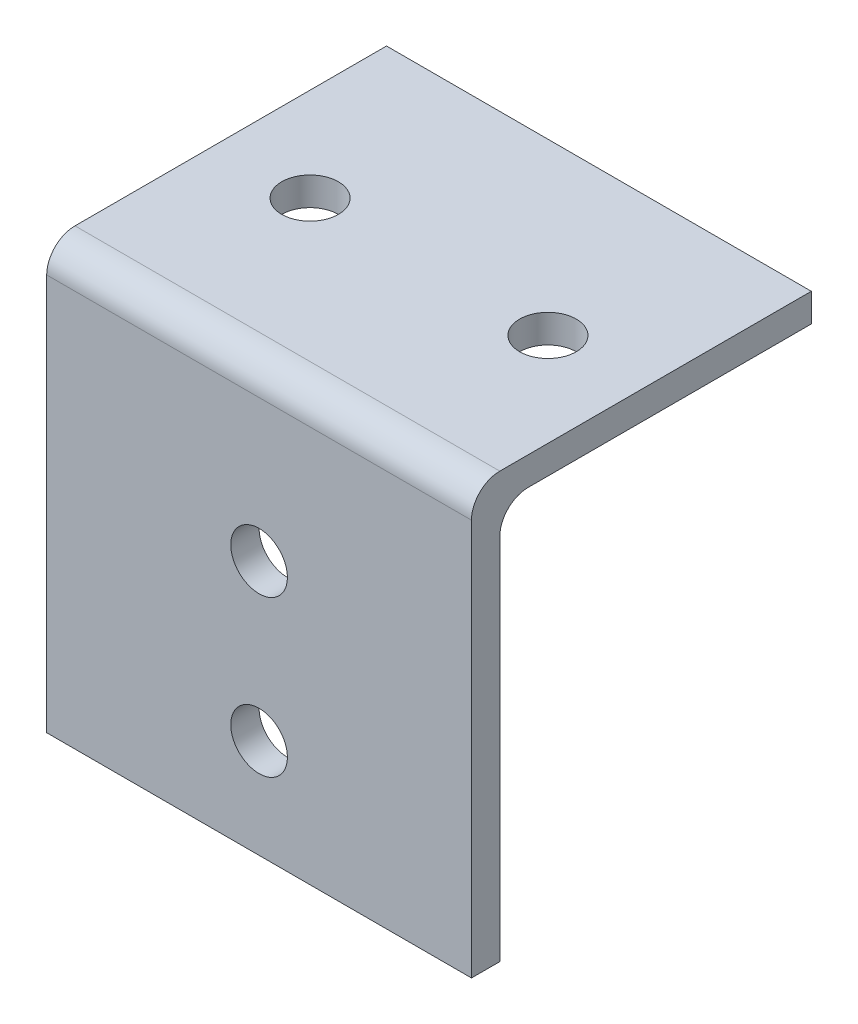
from build123d import *

# Parameters (mm, degrees)
SKETCH1_R           = 2.54
BOSS_EXTRUDE1_DEPTH = 2.54
SKETCH2_W           = 38.1
SKETCH2_H           = 38.1
SKETCH2_R           = 2.54
BOSS_EXTRUDE2_DEPTH = 2.54
FILLET2_R           = 2.54
FILLET3_R           = 2.54


with BuildPart() as part:
    # Sketch1 → Boss-Extrude1 (new body)
    with BuildSketch(Plane(origin=(0, 0, 0), x_dir=(1, 0, 0), z_dir=(0, 1, 0))):
        Polygon((-19.583364039, 14.230768135), (-5.08, 14.230768135), (5.08, 14.230768135), (18.516635961, 14.230768135), (18.516635961, -13.709231865), (-19.583364039, -13.709231865), align=None)
        with Locations(Location((-11.201364039, -1.009231865, 0), (0, 0, 270))):
            Circle(SKETCH1_R, mode=Mode.SUBTRACT)
        with Locations(Location((10.134635961, -1.009231865, 0), (0, 0, 270))):
            Circle(SKETCH1_R, mode=Mode.SUBTRACT)
    extrude(amount=BOSS_EXTRUDE1_DEPTH)

    # Sketch2 → Boss-Extrude2 (add)
    with BuildSketch(Plane.XY.offset(13.709231865)):
        with Locations((-0.533364039, -16.51)):
            Rectangle(SKETCH2_W, SKETCH2_H)
        with Locations((-0.533364039, -12.7)):
            Circle(SKETCH2_R, mode=Mode.SUBTRACT)
        with Locations((-0.533364039, -26.67)):
            Circle(SKETCH2_R, mode=Mode.SUBTRACT)
    extrude(amount=BOSS_EXTRUDE2_DEPTH)

    # Fillet2
    fillet2_edges = [part.edges().sort_by_distance(p)[0] for p in [
        (-0.533364039, 0, 13.709231865),
    ]]
    fillet(fillet2_edges, radius=FILLET2_R)

    # Fillet3
    fillet3_edges = [part.edges().sort_by_distance(p)[0] for p in [
        (-0.533364039, 2.54, 16.249231865),
    ]]
    fillet(fillet3_edges, radius=FILLET3_R)


solid = part.part
